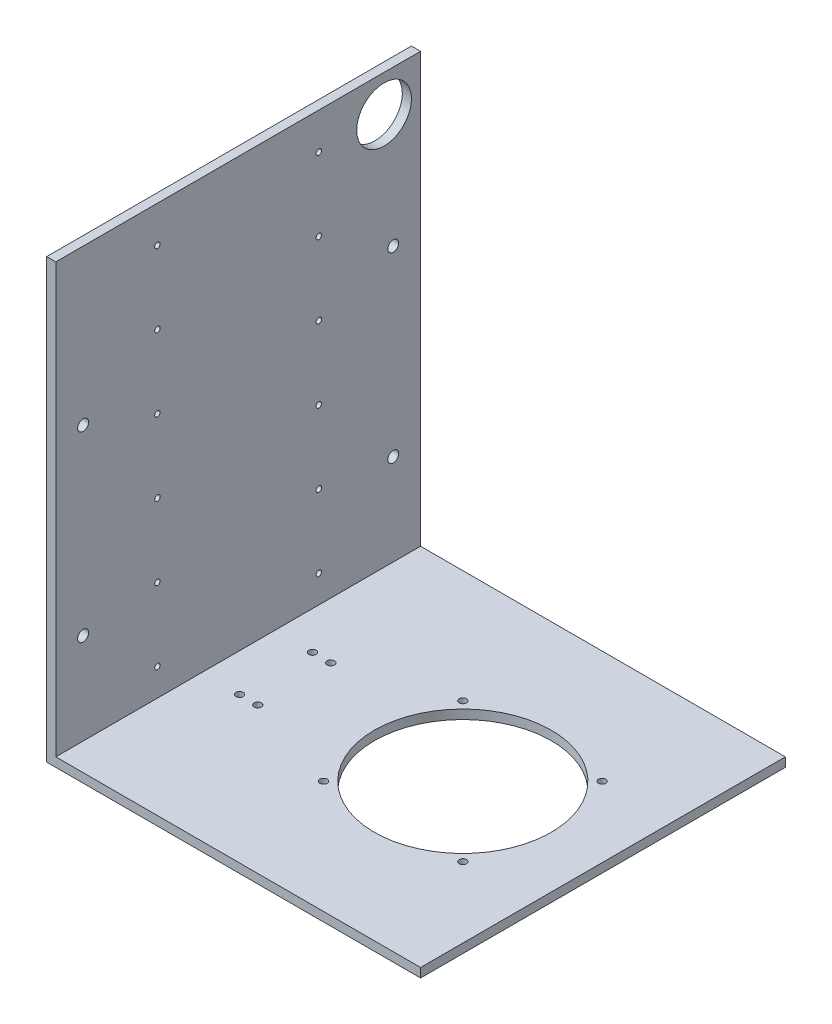
from build123d import *

# Parameters (mm, degrees)
BOSS_EXTRUDE1_DEPTH = 200
CUT_EXTRUDE1_REACH  = 372.473
SKETCH2_R           = 48.5
SKETCH2_R_2         = 2
CUT_EXTRUDE2_REACH  = 372.473
SKETCH3_R           = 2
SKETCH4_R           = 15
CUT_EXTRUDE3_DEPTH  = 10
CUT_EXTRUDE4_REACH  = 372.945
SKETCH5_R           = 3
CUT_EXTRUDE5_REACH  = 372.945
SKETCH6_R           = 1.5


with BuildPart() as part:
    # Sketch1 → Boss-Extrude1 (new body)
    with BuildSketch(Plane.XY):
        Polygon((0, 240), (0, 0), (205, 0), (205, 5), (5, 5), (5, 240), align=None)
    extrude(amount=BOSS_EXTRUDE1_DEPTH)

    # Sketch2 → Cut-Extrude1 (cut, up to next)
    with BuildSketch(Plane(origin=(0, 5, 0), x_dir=(1, 0, 0), z_dir=(0, 1, 0)), mode=Mode.PRIVATE) as cut_extrude1_sk1:
        with Locations(Location((128.16761425, -100, 0), (0, 0, 180))):
            Circle(SKETCH2_R)
    cut_extrude1_tool1 = extrude(cut_extrude1_sk1.sketch, amount=-CUT_EXTRUDE1_REACH, mode=Mode.PRIVATE) & part.part
    # Sketch2 → Cut-Extrude1 (cut, up to next)
    with BuildSketch(Plane(origin=(0, 5, 0), x_dir=(1, 0, 0), z_dir=(0, 1, 0)), mode=Mode.PRIVATE) as cut_extrude1_sk2:
        with Locations(Location((89.98261425, -61.817467672, 0), (0, 0, 180))):
            Circle(SKETCH2_R_2)
    cut_extrude1_tool2 = extrude(cut_extrude1_sk2.sketch, amount=-CUT_EXTRUDE1_REACH, mode=Mode.PRIVATE) & part.part
    # Sketch2 → Cut-Extrude1 (cut, up to next)
    with BuildSketch(Plane(origin=(0, 5, 0), x_dir=(1, 0, 0), z_dir=(0, 1, 0)), mode=Mode.PRIVATE) as cut_extrude1_sk3:
        with Locations(Location((166.35261425, -61.817467672, 0), (0, 0, 180))):
            Circle(SKETCH2_R_2)
    cut_extrude1_tool3 = extrude(cut_extrude1_sk3.sketch, amount=-CUT_EXTRUDE1_REACH, mode=Mode.PRIVATE) & part.part
    # Sketch2 → Cut-Extrude1 (cut, up to next)
    with BuildSketch(Plane(origin=(0, 5, 0), x_dir=(1, 0, 0), z_dir=(0, 1, 0)), mode=Mode.PRIVATE) as cut_extrude1_sk4:
        with Locations(Location((89.98261425, -138.182532328, 0), (0, 0, 180))):
            Circle(SKETCH2_R_2)
    cut_extrude1_tool4 = extrude(cut_extrude1_sk4.sketch, amount=-CUT_EXTRUDE1_REACH, mode=Mode.PRIVATE) & part.part
    # Sketch2 → Cut-Extrude1 (cut, up to next)
    with BuildSketch(Plane(origin=(0, 5, 0), x_dir=(1, 0, 0), z_dir=(0, 1, 0)), mode=Mode.PRIVATE) as cut_extrude1_sk5:
        with Locations(Location((166.35261425, -138.182532328, 0), (0, 0, 180))):
            Circle(SKETCH2_R_2)
    cut_extrude1_tool5 = extrude(cut_extrude1_sk5.sketch, amount=-CUT_EXTRUDE1_REACH, mode=Mode.PRIVATE) & part.part
    add(cut_extrude1_tool1.solids().sort_by_distance((128.167614, 5, 100))[0], mode=Mode.SUBTRACT)
    add(cut_extrude1_tool2.solids().sort_by_distance((89.982614, 5, 61.817468))[0], mode=Mode.SUBTRACT)
    add(cut_extrude1_tool3.solids().sort_by_distance((166.352614, 5, 61.817468))[0], mode=Mode.SUBTRACT)
    add(cut_extrude1_tool4.solids().sort_by_distance((89.982614, 5, 138.182532))[0], mode=Mode.SUBTRACT)
    add(cut_extrude1_tool5.solids().sort_by_distance((166.352614, 5, 138.182532))[0], mode=Mode.SUBTRACT)

    # Sketch3 → Cut-Extrude2 (cut, up to next)
    with BuildSketch(Plane(origin=(0, 5, 0), x_dir=(1, 0, 0), z_dir=(0, 1, 0)), mode=Mode.PRIVATE) as cut_extrude2_sk1:
        with Locations(Location((25.75, -80, 0), (0, 0, 180))):
            Circle(SKETCH3_R)
    cut_extrude2_tool1 = extrude(cut_extrude2_sk1.sketch, amount=-CUT_EXTRUDE2_REACH, mode=Mode.PRIVATE) & part.part
    # Sketch3 → Cut-Extrude2 (cut, up to next)
    with BuildSketch(Plane(origin=(0, 5, 0), x_dir=(1, 0, 0), z_dir=(0, 1, 0)), mode=Mode.PRIVATE) as cut_extrude2_sk2:
        with Locations(Location((25.75, -120, 0), (0, 0, 270))):
            Circle(SKETCH3_R)
    cut_extrude2_tool2 = extrude(cut_extrude2_sk2.sketch, amount=-CUT_EXTRUDE2_REACH, mode=Mode.PRIVATE) & part.part
    # Sketch3 → Cut-Extrude2 (cut, up to next)
    with BuildSketch(Plane(origin=(0, 5, 0), x_dir=(1, 0, 0), z_dir=(0, 1, 0)), mode=Mode.PRIVATE) as cut_extrude2_sk3:
        with Locations(Location((35.75, -120, 0), (0, 0, 180))):
            Circle(SKETCH3_R)
    cut_extrude2_tool3 = extrude(cut_extrude2_sk3.sketch, amount=-CUT_EXTRUDE2_REACH, mode=Mode.PRIVATE) & part.part
    # Sketch3 → Cut-Extrude2 (cut, up to next)
    with BuildSketch(Plane(origin=(0, 5, 0), x_dir=(1, 0, 0), z_dir=(0, 1, 0)), mode=Mode.PRIVATE) as cut_extrude2_sk4:
        with Locations(Location((35.75, -80, 0), (0, 0, 270))):
            Circle(SKETCH3_R)
    cut_extrude2_tool4 = extrude(cut_extrude2_sk4.sketch, amount=-CUT_EXTRUDE2_REACH, mode=Mode.PRIVATE) & part.part
    add(cut_extrude2_tool1.solids().sort_by_distance((25.75, 5, 80))[0], mode=Mode.SUBTRACT)
    add(cut_extrude2_tool2.solids().sort_by_distance((25.75, 5, 120))[0], mode=Mode.SUBTRACT)
    add(cut_extrude2_tool3.solids().sort_by_distance((35.75, 5, 120))[0], mode=Mode.SUBTRACT)
    add(cut_extrude2_tool4.solids().sort_by_distance((35.75, 5, 80))[0], mode=Mode.SUBTRACT)

    # Sketch4 → Cut-Extrude3 (cut)
    with BuildSketch(Plane(origin=(5, 0, 0), x_dir=(0, 0, -1), z_dir=(1, 0, 0))):
        with Locations(Location((-20, 220, 0), (0, 0, 90))):
            Circle(SKETCH4_R)
    extrude(amount=-CUT_EXTRUDE3_DEPTH, mode=Mode.SUBTRACT)

    # Sketch5 → Cut-Extrude4 (cut, up to next)
    with BuildSketch(Plane(origin=(5, 0, 0), x_dir=(0, 0, -1), z_dir=(1, 0, 0)), mode=Mode.PRIVATE) as cut_extrude4_sk1:
        with Locations(Location((-185, 55, 0), (0, 0, 90))):
            Circle(SKETCH5_R)
    cut_extrude4_tool1 = extrude(cut_extrude4_sk1.sketch, amount=-CUT_EXTRUDE4_REACH, mode=Mode.PRIVATE) & part.part
    # Sketch5 → Cut-Extrude4 (cut, up to next)
    with BuildSketch(Plane(origin=(5, 0, 0), x_dir=(0, 0, -1), z_dir=(1, 0, 0)), mode=Mode.PRIVATE) as cut_extrude4_sk2:
        with Locations(Location((-185, 155, 0), (0, 0, 90))):
            Circle(SKETCH5_R)
    cut_extrude4_tool2 = extrude(cut_extrude4_sk2.sketch, amount=-CUT_EXTRUDE4_REACH, mode=Mode.PRIVATE) & part.part
    # Sketch5 → Cut-Extrude4 (cut, up to next)
    with BuildSketch(Plane(origin=(5, 0, 0), x_dir=(0, 0, -1), z_dir=(1, 0, 0)), mode=Mode.PRIVATE) as cut_extrude4_sk3:
        with Locations(Location((-15, 55, 0), (0, 0, 90))):
            Circle(SKETCH5_R)
    cut_extrude4_tool3 = extrude(cut_extrude4_sk3.sketch, amount=-CUT_EXTRUDE4_REACH, mode=Mode.PRIVATE) & part.part
    # Sketch5 → Cut-Extrude4 (cut, up to next)
    with BuildSketch(Plane(origin=(5, 0, 0), x_dir=(0, 0, -1), z_dir=(1, 0, 0)), mode=Mode.PRIVATE) as cut_extrude4_sk4:
        with Locations(Location((-15, 155, 0), (0, 0, 90))):
            Circle(SKETCH5_R)
    cut_extrude4_tool4 = extrude(cut_extrude4_sk4.sketch, amount=-CUT_EXTRUDE4_REACH, mode=Mode.PRIVATE) & part.part
    add(cut_extrude4_tool1.solids().sort_by_distance((5, 55, 185))[0], mode=Mode.SUBTRACT)
    add(cut_extrude4_tool2.solids().sort_by_distance((5, 155, 185))[0], mode=Mode.SUBTRACT)
    add(cut_extrude4_tool3.solids().sort_by_distance((5, 55, 15))[0], mode=Mode.SUBTRACT)
    add(cut_extrude4_tool4.solids().sort_by_distance((5, 155, 15))[0], mode=Mode.SUBTRACT)

    # Sketch6 → Cut-Extrude5 (cut, up to next)
    with BuildSketch(Plane(origin=(5, 0, 0), x_dir=(0, 0, -1), z_dir=(1, 0, 0)), mode=Mode.PRIVATE) as cut_extrude5_sk1:
        with Locations(Location((-144.25, 220, 0), (0, 0, 90))):
            Circle(SKETCH6_R)
    cut_extrude5_tool1 = extrude(cut_extrude5_sk1.sketch, amount=-CUT_EXTRUDE5_REACH, mode=Mode.PRIVATE) & part.part
    # Sketch6 → Cut-Extrude5 (cut, up to next)
    with BuildSketch(Plane(origin=(5, 0, 0), x_dir=(0, 0, -1), z_dir=(1, 0, 0)), mode=Mode.PRIVATE) as cut_extrude5_sk2:
        with Locations(Location((-55.75, 220, 0), (0, 0, 90))):
            Circle(SKETCH6_R)
    cut_extrude5_tool2 = extrude(cut_extrude5_sk2.sketch, amount=-CUT_EXTRUDE5_REACH, mode=Mode.PRIVATE) & part.part
    # Sketch6 → Cut-Extrude5 (cut, up to next)
    with BuildSketch(Plane(origin=(5, 0, 0), x_dir=(0, 0, -1), z_dir=(1, 0, 0)), mode=Mode.PRIVATE) as cut_extrude5_sk3:
        with Locations(Location((-144.25, 180, 0), (0, 0, 90))):
            Circle(SKETCH6_R)
    cut_extrude5_tool3 = extrude(cut_extrude5_sk3.sketch, amount=-CUT_EXTRUDE5_REACH, mode=Mode.PRIVATE) & part.part
    # Sketch6 → Cut-Extrude5 (cut, up to next)
    with BuildSketch(Plane(origin=(5, 0, 0), x_dir=(0, 0, -1), z_dir=(1, 0, 0)), mode=Mode.PRIVATE) as cut_extrude5_sk4:
        with Locations(Location((-55.75, 180, 0), (0, 0, 90))):
            Circle(SKETCH6_R)
    cut_extrude5_tool4 = extrude(cut_extrude5_sk4.sketch, amount=-CUT_EXTRUDE5_REACH, mode=Mode.PRIVATE) & part.part
    # Sketch6 → Cut-Extrude5 (cut, up to next)
    with BuildSketch(Plane(origin=(5, 0, 0), x_dir=(0, 0, -1), z_dir=(1, 0, 0)), mode=Mode.PRIVATE) as cut_extrude5_sk5:
        with Locations(Location((-144.25, 140, 0), (0, 0, 90))):
            Circle(SKETCH6_R)
    cut_extrude5_tool5 = extrude(cut_extrude5_sk5.sketch, amount=-CUT_EXTRUDE5_REACH, mode=Mode.PRIVATE) & part.part
    # Sketch6 → Cut-Extrude5 (cut, up to next)
    with BuildSketch(Plane(origin=(5, 0, 0), x_dir=(0, 0, -1), z_dir=(1, 0, 0)), mode=Mode.PRIVATE) as cut_extrude5_sk6:
        with Locations(Location((-55.75, 140, 0), (0, 0, 90))):
            Circle(SKETCH6_R)
    cut_extrude5_tool6 = extrude(cut_extrude5_sk6.sketch, amount=-CUT_EXTRUDE5_REACH, mode=Mode.PRIVATE) & part.part
    # Sketch6 → Cut-Extrude5 (cut, up to next)
    with BuildSketch(Plane(origin=(5, 0, 0), x_dir=(0, 0, -1), z_dir=(1, 0, 0)), mode=Mode.PRIVATE) as cut_extrude5_sk7:
        with Locations(Location((-144.25, 100, 0), (0, 0, 90))):
            Circle(SKETCH6_R)
    cut_extrude5_tool7 = extrude(cut_extrude5_sk7.sketch, amount=-CUT_EXTRUDE5_REACH, mode=Mode.PRIVATE) & part.part
    # Sketch6 → Cut-Extrude5 (cut, up to next)
    with BuildSketch(Plane(origin=(5, 0, 0), x_dir=(0, 0, -1), z_dir=(1, 0, 0)), mode=Mode.PRIVATE) as cut_extrude5_sk8:
        with Locations(Location((-55.75, 100, 0), (0, 0, 90))):
            Circle(SKETCH6_R)
    cut_extrude5_tool8 = extrude(cut_extrude5_sk8.sketch, amount=-CUT_EXTRUDE5_REACH, mode=Mode.PRIVATE) & part.part
    # Sketch6 → Cut-Extrude5 (cut, up to next)
    with BuildSketch(Plane(origin=(5, 0, 0), x_dir=(0, 0, -1), z_dir=(1, 0, 0)), mode=Mode.PRIVATE) as cut_extrude5_sk9:
        with Locations(Location((-144.25, 60, 0), (0, 0, 90))):
            Circle(SKETCH6_R)
    cut_extrude5_tool9 = extrude(cut_extrude5_sk9.sketch, amount=-CUT_EXTRUDE5_REACH, mode=Mode.PRIVATE) & part.part
    # Sketch6 → Cut-Extrude5 (cut, up to next)
    with BuildSketch(Plane(origin=(5, 0, 0), x_dir=(0, 0, -1), z_dir=(1, 0, 0)), mode=Mode.PRIVATE) as cut_extrude5_sk10:
        with Locations(Location((-55.75, 60, 0), (0, 0, 90))):
            Circle(SKETCH6_R)
    cut_extrude5_tool10 = extrude(cut_extrude5_sk10.sketch, amount=-CUT_EXTRUDE5_REACH, mode=Mode.PRIVATE) & part.part
    # Sketch6 → Cut-Extrude5 (cut, up to next)
    with BuildSketch(Plane(origin=(5, 0, 0), x_dir=(0, 0, -1), z_dir=(1, 0, 0)), mode=Mode.PRIVATE) as cut_extrude5_sk11:
        with Locations(Location((-144.25, 20, 0), (0, 0, 90))):
            Circle(SKETCH6_R)
    cut_extrude5_tool11 = extrude(cut_extrude5_sk11.sketch, amount=-CUT_EXTRUDE5_REACH, mode=Mode.PRIVATE) & part.part
    # Sketch6 → Cut-Extrude5 (cut, up to next)
    with BuildSketch(Plane(origin=(5, 0, 0), x_dir=(0, 0, -1), z_dir=(1, 0, 0)), mode=Mode.PRIVATE) as cut_extrude5_sk12:
        with Locations(Location((-55.75, 20, 0), (0, 0, 90))):
            Circle(SKETCH6_R)
    cut_extrude5_tool12 = extrude(cut_extrude5_sk12.sketch, amount=-CUT_EXTRUDE5_REACH, mode=Mode.PRIVATE) & part.part
    add(cut_extrude5_tool1.solids().sort_by_distance((5, 220, 144.25))[0], mode=Mode.SUBTRACT)
    add(cut_extrude5_tool2.solids().sort_by_distance((5, 220, 55.75))[0], mode=Mode.SUBTRACT)
    add(cut_extrude5_tool3.solids().sort_by_distance((5, 180, 144.25))[0], mode=Mode.SUBTRACT)
    add(cut_extrude5_tool4.solids().sort_by_distance((5, 180, 55.75))[0], mode=Mode.SUBTRACT)
    add(cut_extrude5_tool5.solids().sort_by_distance((5, 140, 144.25))[0], mode=Mode.SUBTRACT)
    add(cut_extrude5_tool6.solids().sort_by_distance((5, 140, 55.75))[0], mode=Mode.SUBTRACT)
    add(cut_extrude5_tool7.solids().sort_by_distance((5, 100, 144.25))[0], mode=Mode.SUBTRACT)
    add(cut_extrude5_tool8.solids().sort_by_distance((5, 100, 55.75))[0], mode=Mode.SUBTRACT)
    add(cut_extrude5_tool9.solids().sort_by_distance((5, 60, 144.25))[0], mode=Mode.SUBTRACT)
    add(cut_extrude5_tool10.solids().sort_by_distance((5, 60, 55.75))[0], mode=Mode.SUBTRACT)
    add(cut_extrude5_tool11.solids().sort_by_distance((5, 20, 144.25))[0], mode=Mode.SUBTRACT)
    add(cut_extrude5_tool12.solids().sort_by_distance((5, 20, 55.75))[0], mode=Mode.SUBTRACT)


solid = part.part
